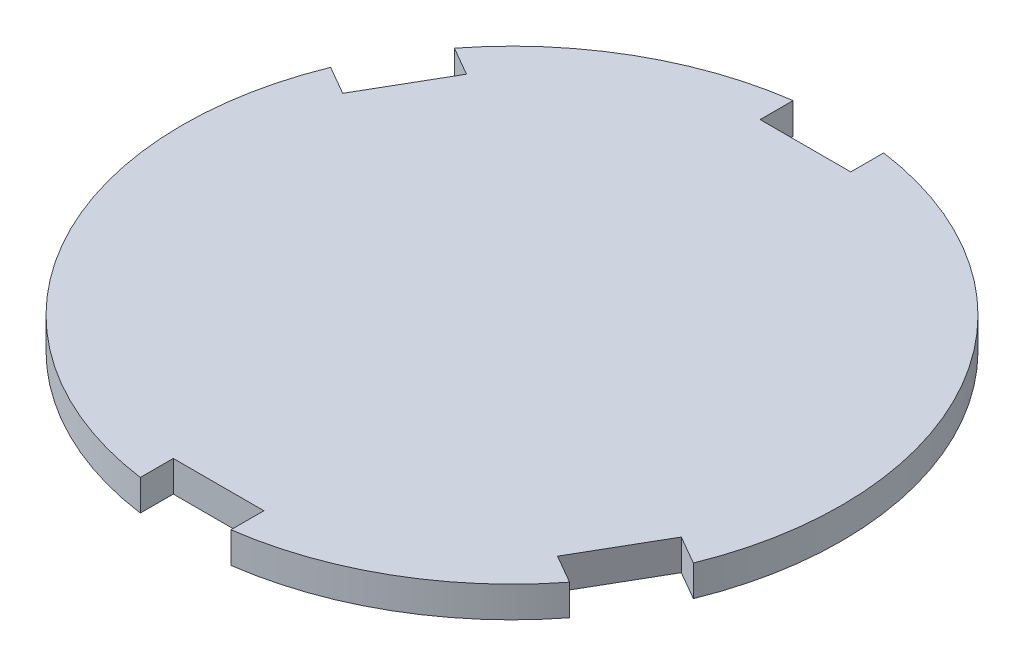
from build123d import *

# Parameters (mm, degrees)
SKETCH1_R           = 50.8
BOSS_EXTRUDE1_DEPTH = 4.7625
CUT_EXTRUDE1_REACH  = 74
CUT_EXTRUDE2_REACH  = 73.66


with BuildPart() as part:
    # Sketch1 → Boss-Extrude1 (new body)
    with BuildSketch(Plane(origin=(0, 0, 0), x_dir=(1, 0, 0), z_dir=(0, 1, 0))):
        with Locations(Location((0, 0, 0), (0, 0, 90))):
            Circle(SKETCH1_R)
    extrude(amount=BOSS_EXTRUDE1_DEPTH)

    # Sketch2 → Cut-Extrude1 (cut, up to next)
    with BuildSketch(Plane(origin=(0, 4.7625, 0), x_dir=(1, 0, 0), z_dir=(0, 1, 0)), mode=Mode.PRIVATE) as cut_extrude1_sk1:
        with BuildLine():
            Line((-6.985, -45.237489753), (6.985, -45.237489753))
            Line((6.985, -45.237489753), (6.985, -50.317489753))
            ThreePointArc((6.985, -50.317489753), (0, -50.8), (-6.985, -50.317489753))
            Line((-6.985, -50.317489753), (-6.985, -45.237489753))
        make_face()
    cut_extrude1_tool1 = extrude(cut_extrude1_sk1.sketch, amount=-CUT_EXTRUDE1_REACH, mode=Mode.PRIVATE) & part.part
    # Sketch2 → Cut-Extrude1 (cut, up to next)
    with BuildSketch(Plane(origin=(0, 4.7625, 0), x_dir=(1, 0, 0), z_dir=(0, 1, 0)), mode=Mode.PRIVATE) as cut_extrude1_sk2:
        with BuildLine():
            Line((-6.985, 45.237489753), (-6.985, 50.317489753))
            ThreePointArc((-6.985, 50.317489753), (0, 50.8), (6.985, 50.317489753))
            Line((6.985, 50.317489753), (6.985, 45.237489753))
            Line((6.985, 45.237489753), (-6.985, 45.237489753))
        make_face()
    cut_extrude1_tool2 = extrude(cut_extrude1_sk2.sketch, amount=-CUT_EXTRUDE1_REACH, mode=Mode.PRIVATE) & part.part
    add(cut_extrude1_tool1.solids().sort_by_distance((0, 4.7625, 47.940393))[0], mode=Mode.SUBTRACT)
    add(cut_extrude1_tool2.solids().sort_by_distance((0, 4.7625, -47.940393))[0], mode=Mode.SUBTRACT)

    # Sketch3 → Cut-Extrude2 (cut, up to next)
    with BuildSketch(Plane(origin=(0, 4.7625, 0), x_dir=(1, 0, 0), z_dir=(0, 1, 0)), mode=Mode.PRIVATE) as cut_extrude2_sk1:
        with BuildLine():
            Line((35.684315329, -28.667932322), (42.669315329, -16.569557431))
            Line((42.669315329, -16.569557431), (47.06872438, -19.109557431))
            ThreePointArc((47.06872438, -19.109557431), (43.994090512, -25.4), (40.08372438, -31.207932322))
            Line((40.08372438, -31.207932322), (35.684315329, -28.667932322))
        make_face()
    cut_extrude2_tool1 = extrude(cut_extrude2_sk1.sketch, amount=-CUT_EXTRUDE2_REACH, mode=Mode.PRIVATE) & part.part
    # Sketch3 → Cut-Extrude2 (cut, up to next)
    with BuildSketch(Plane(origin=(0, 4.7625, 0), x_dir=(1, 0, 0), z_dir=(0, 1, 0)), mode=Mode.PRIVATE) as cut_extrude2_sk2:
        with BuildLine():
            Line((-35.684315329, 28.667932322), (-40.08372438, 31.207932322))
            ThreePointArc((-40.08372438, 31.207932322), (-43.994090512, 25.4), (-47.06872438, 19.109557431))
            Line((-47.06872438, 19.109557431), (-42.669315329, 16.569557431))
            Line((-42.669315329, 16.569557431), (-35.684315329, 28.667932322))
        make_face()
    cut_extrude2_tool2 = extrude(cut_extrude2_sk2.sketch, amount=-CUT_EXTRUDE2_REACH, mode=Mode.PRIVATE) & part.part
    add(cut_extrude2_tool1.solids().sort_by_distance((41.517598, 4.7625, 23.970196))[0], mode=Mode.SUBTRACT)
    add(cut_extrude2_tool2.solids().sort_by_distance((-41.517598, 4.7625, -23.970196))[0], mode=Mode.SUBTRACT)


solid = part.part
